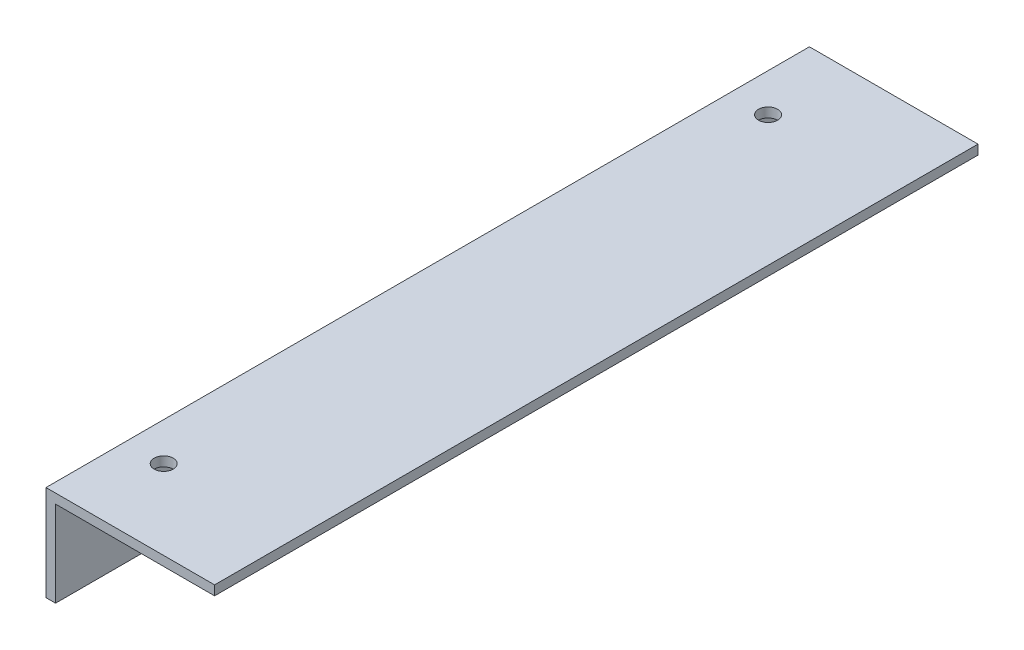
from build123d import *

# Parameters (mm, degrees)
EXTRUDE_1_DEPTH     = 120
SKETCH_2_R          = 1.5
CUT_EXTRUDE_1_DEPTH = 124.490890352
SKETCH_3_R          = 1.5
CUT_EXTRUDE_2_DEPTH = 124.803271362


with BuildPart() as part:
    # 草图1 → 凸台-拉伸1 (new body)
    with BuildSketch(Plane.XY):
        Polygon((0, 0), (26.5, 0), (26.5, -1.5), (1.5, -1.5), (1.5, -15), (0, -15), align=None)
    extrude(amount=EXTRUDE_1_DEPTH)

    # 草图2 → 切除-拉伸1 (cut, through all)
    with BuildSketch(Plane(origin=(1.5, 0, 0), x_dir=(0, 0, -1), z_dir=(1, 0, 0))):
        with Locations(Location((-60, -7.5, 0), (0, 0, 90))):
            Circle(SKETCH_2_R)
        with Locations(Location((-107, -7.5, 0), (0, 0, 90))):
            Circle(SKETCH_2_R)
        with Locations(Location((-13, -7.5, 0), (0, 0, 90))):
            Circle(SKETCH_2_R)
    extrude(amount=-CUT_EXTRUDE_1_DEPTH, mode=Mode.SUBTRACT)

    # 草图3 → 切除-拉伸2 (cut, through all)
    with BuildSketch(Plane(origin=(0, 0, 0), x_dir=(1, 0, 0), z_dir=(0, 1, 0))):
        with Locations(Location((6, -107.5, 0), (0, 0, 270))):
            Circle(SKETCH_3_R)
        with Locations(Location((6, -12.5, 0), (0, 0, 270))):
            Circle(SKETCH_3_R)
    extrude(amount=-CUT_EXTRUDE_2_DEPTH, mode=Mode.SUBTRACT)


solid = part.part
